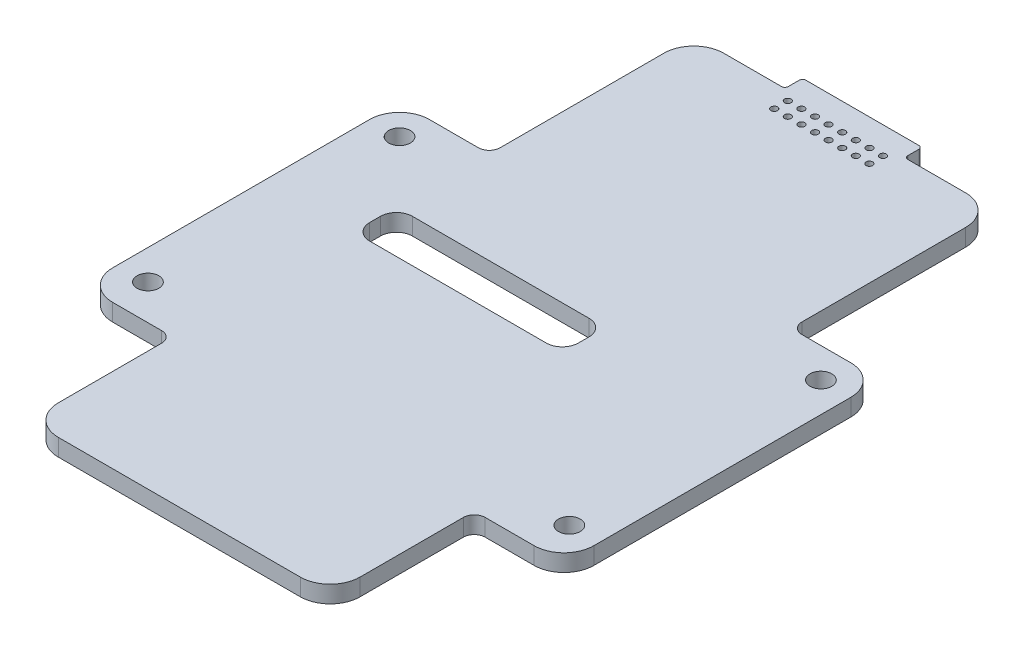
from build123d import *

# Parameters (mm, degrees)
BOSS_EXTRUDE1_DEPTH = 1.6
SKETCH2_R           = 1.016
CUT_EXTRUDE1_DEPTH  = 44.666207109
SKETCH3_R           = 0.3048
CUT_EXTRUDE2_DEPTH  = 44.666207109
CUT_EXTRUDE3_DEPTH  = 44.666207109


with BuildPart() as part:
    # Sketch6 → Boss-Extrude1 (new body)
    with BuildSketch(Plane(origin=(0, 3.4925, 0), x_dir=(1, 0, 0), z_dir=(0, 1, 0))):
        with BuildLine():
            Line((14.097, 17.653), (14.097, 32.9565))
            ThreePointArc((14.097, 32.9565), (13.278656347, 34.932156347), (11.303, 35.7505))
            Line((11.303, 35.7505), (5.9055, 35.7505))
            ThreePointArc((5.9055, 35.7505), (5.680993597, 35.843493597), (5.588, 36.068))
            Line((5.588, 36.068), (5.588, 37.084))
            ThreePointArc((5.588, 37.084), (5.495006403, 37.308506403), (5.2705, 37.4015))
            Line((5.2705, 37.4015), (-5.2705, 37.4015))
            ThreePointArc((-5.2705, 37.4015), (-5.495006403, 37.308506403), (-5.588, 37.084))
            Line((-5.588, 37.084), (-5.588, 36.068))
            ThreePointArc((-5.588, 36.068), (-5.680993597, 35.843493597), (-5.9055, 35.7505))
            Line((-5.9055, 35.7505), (-11.303, 35.7505))
            ThreePointArc((-11.303, 35.7505), (-13.278656347, 34.932156347), (-14.097, 32.9565))
            Line((-14.097, 32.9565), (-14.097, 17.653))
            ThreePointArc((-14.097, 17.653), (-14.39457951, 16.93457951), (-15.113, 16.637))
            Line((-15.113, 16.637), (-19.685, 16.637))
            ThreePointArc((-19.685, 16.637), (-21.660656347, 15.818656347), (-22.479, 13.843))
            Line((-22.479, 13.843), (-22.479, -10.16))
            ThreePointArc((-22.479, -10.16), (-21.660656347, -12.135656347), (-19.685, -12.954))
            Line((-19.685, -12.954), (-15.113, -12.954))
            ThreePointArc((-15.113, -12.954), (-14.39457951, -13.25157951), (-14.097, -13.97))
            Line((-14.097, -13.97), (-14.097, -17.653))
            Line((-14.097, -17.653), (-14.097, -23.622))
            ThreePointArc((-14.097, -23.622), (-13.278656347, -25.597656347), (-11.303, -26.416))
            Line((-11.303, -26.416), (11.303, -26.416))
            ThreePointArc((11.303, -26.416), (13.278656347, -25.597656347), (14.097, -23.622))
            Line((14.097, -23.622), (14.097, -17.653))
            Line((14.097, -17.653), (14.097, -13.97))
            ThreePointArc((14.097, -13.97), (14.39457951, -13.25157951), (15.113, -12.954))
            Line((15.113, -12.954), (19.685, -12.954))
            ThreePointArc((19.685, -12.954), (21.660656347, -12.135656347), (22.479, -10.16))
            Line((22.479, -10.16), (22.479, 13.843))
            ThreePointArc((22.479, 13.843), (21.660656347, 15.818656347), (19.685, 16.637))
            Line((19.685, 16.637), (15.113, 16.637))
            ThreePointArc((15.113, 16.637), (14.39457951, 16.93457951), (14.097, 17.653))
        make_face()
    extrude(amount=BOSS_EXTRUDE1_DEPTH)

    # Sketch2 → Cut-Extrude1 (cut, through all)
    with BuildSketch(Plane(origin=(0, 3.4925, 0), x_dir=(1, 0, 0), z_dir=(0, 1, 0))):
        with Locations(Location((19.685, 13.843, 0), (0, 0, 90))):
            Circle(SKETCH2_R)
        with Locations(Location((19.685, -9.66, 0), (0, 0, 90))):
            Circle(SKETCH2_R)
        with Locations(Location((-19.685, -9.66, 0), (0, 0, 90))):
            Circle(SKETCH2_R)
        with Locations(Location((-19.685, 13.843, 0), (0, 0, 90))):
            Circle(SKETCH2_R)
    extrude(amount=CUT_EXTRUDE1_DEPTH, mode=Mode.SUBTRACT)

    # Sketch3 → Cut-Extrude2 (cut, through all)
    with BuildSketch(Plane(origin=(0, 3.4925, 0), x_dir=(1, 0, 0), z_dir=(0, 1, 0))):
        with Locations(Location((-4.445, 33.613, 0), (0, 0, 270))):
            Circle(SKETCH3_R)
        with Locations(Location((-3.175, 33.613, 0), (0, 0, 270))):
            Circle(SKETCH3_R)
        with Locations(Location((-1.905, 33.613, 0), (0, 0, 270))):
            Circle(SKETCH3_R)
        with Locations(Location((-0.635, 33.613, 0), (0, 0, 270))):
            Circle(SKETCH3_R)
        with Locations(Location((0.635, 33.613, 0), (0, 0, 270))):
            Circle(SKETCH3_R)
        with Locations(Location((1.905, 33.613, 0), (0, 0, 270))):
            Circle(SKETCH3_R)
        with Locations(Location((3.175, 33.613, 0), (0, 0, 270))):
            Circle(SKETCH3_R)
        with Locations(Location((4.445, 33.613, 0), (0, 0, 270))):
            Circle(SKETCH3_R)
        with Locations(Location((-3.175, 34.883, 0), (0, 0, 270))):
            Circle(SKETCH3_R)
        with Locations(Location((-1.905, 34.883, 0), (0, 0, 270))):
            Circle(SKETCH3_R)
        with Locations(Location((-0.635, 34.883, 0), (0, 0, 270))):
            Circle(SKETCH3_R)
        with Locations(Location((0.635, 34.883, 0), (0, 0, 270))):
            Circle(SKETCH3_R)
        with Locations(Location((1.905, 34.883, 0), (0, 0, 270))):
            Circle(SKETCH3_R)
        with Locations(Location((3.175, 34.883, 0), (0, 0, 270))):
            Circle(SKETCH3_R)
        with Locations(Location((4.445, 34.883, 0), (0, 0, 270))):
            Circle(SKETCH3_R)
        with Locations(Location((-4.445, 34.883, 0), (0, 0, 270))):
            Circle(SKETCH3_R)
    extrude(amount=CUT_EXTRUDE2_DEPTH, mode=Mode.SUBTRACT)

    # Sketch8 → Cut-Extrude3 (cut, through all)
    with BuildSketch(Plane.XZ.offset(-3.4925)):
        with BuildLine():
            Line((-12.64, -4.01), (3.86, -4.01))
            ThreePointArc((3.86, -4.01), (4.920660172, -4.449339828), (5.36, -5.51))
            Line((5.36, -5.51), (5.36, -6.51))
            ThreePointArc((5.36, -6.51), (4.920660172, -7.570660172), (3.86, -8.01))
            Line((3.86, -8.01), (-12.64, -8.01))
            ThreePointArc((-12.64, -8.01), (-13.700660172, -7.570660172), (-14.14, -6.51))
            Line((-14.14, -6.51), (-14.14, -5.51))
            ThreePointArc((-14.14, -5.51), (-13.700660172, -4.449339828), (-12.64, -4.01))
        make_face()
    extrude(amount=-CUT_EXTRUDE3_DEPTH, mode=Mode.SUBTRACT)


solid = part.part
